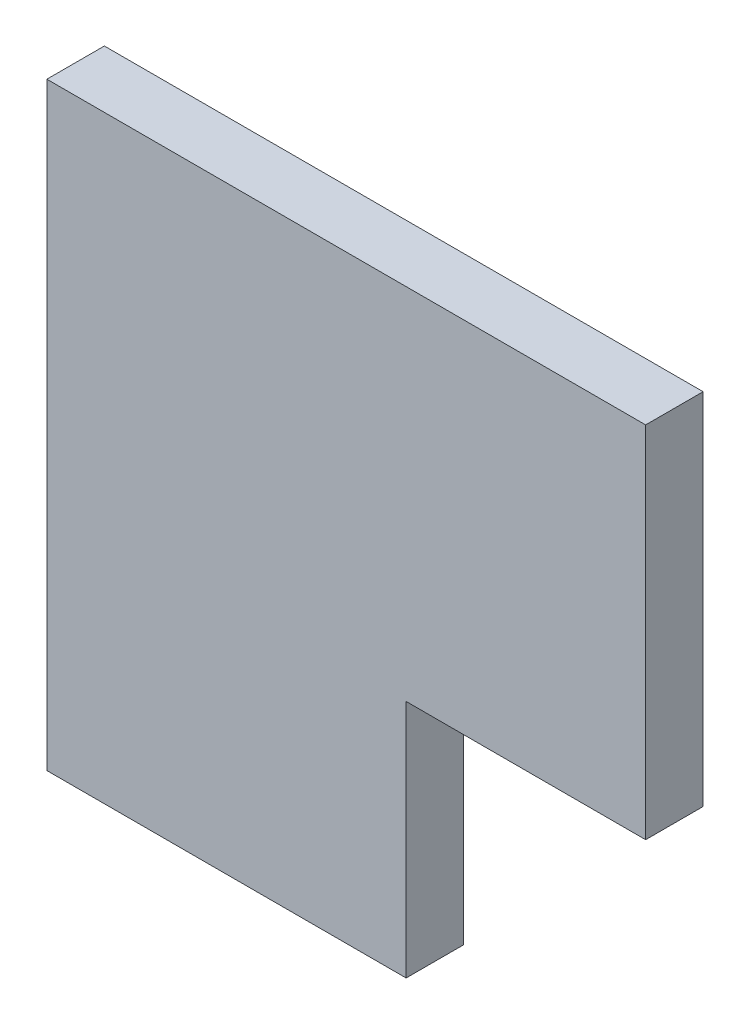
from build123d import *

# Parameters (mm, degrees)
BOSS_EXTRUDE1_DEPTH = 0.12


with BuildPart() as part:
    # Sketch1 → Boss-Extrude1 (new, symmetric)
    with BuildSketch(Plane.XY):
        Polygon((0, 0), (0, 1.5), (-2.5, 1.5), (-2.5, -1), (-1, -1), (-1, 0), align=None)
    extrude(amount=BOSS_EXTRUDE1_DEPTH, both=True)


solid = part.part
